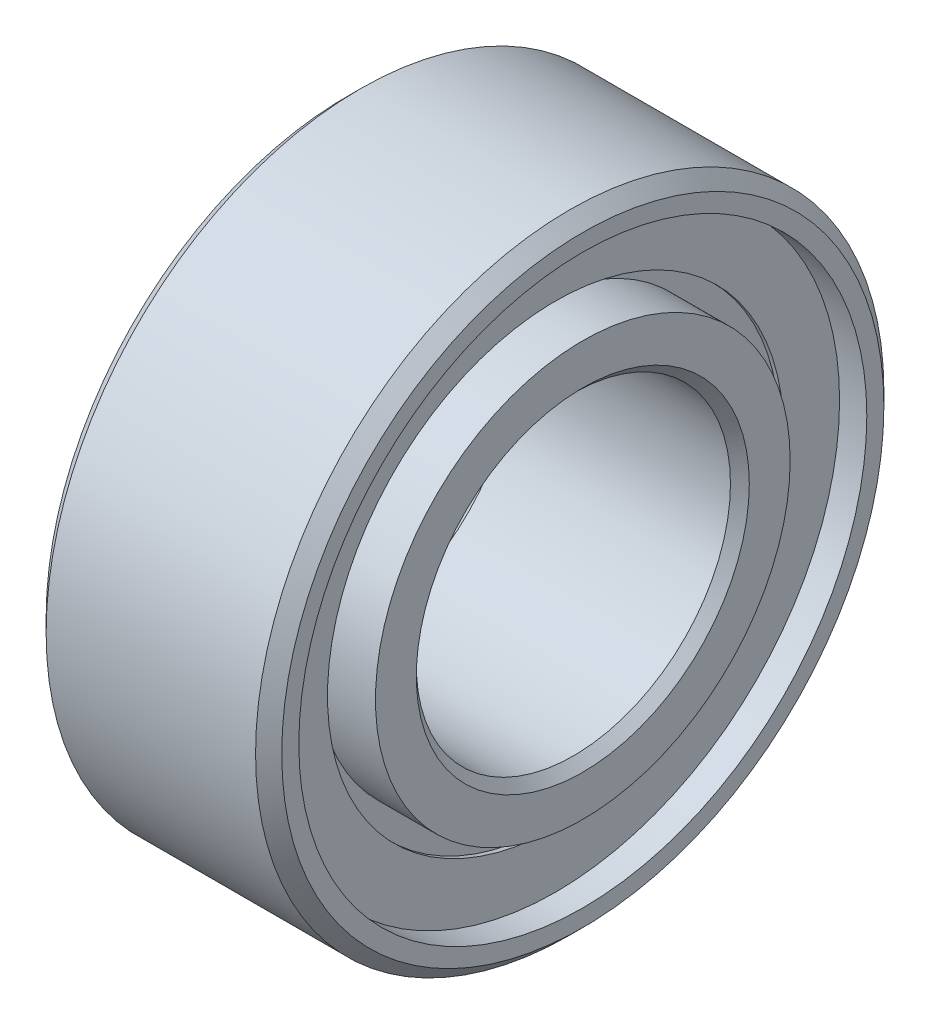
from build123d import *


with BuildPart() as part:
    # Sketch1 → Revolve1 (revolve)
    with BuildSketch(Plane.XY, mode=Mode.PRIVATE) as revolve1_sk:
        Polygon((-2.38125, 3.3655), (-2.19075, 3.175), (2.19075, 3.175), (2.38125, 3.3655), (2.38125, 4.191), (1.190625, 4.191), (1.190625, 5.7404), (1.741289063, 5.7404), (1.741289063, 4.6101), (1.830585938, 4.6101), (1.830585938, 5.7404), (2.38125, 5.7404), (2.38125, 6.085416667), (2.116666667, 6.35), (-2.116666667, 6.35), (-2.38125, 6.085416667), (-2.38125, 5.7404), (-1.830585937, 5.7404), (-1.830585937, 4.6101), (-1.741289062, 4.6101), (-1.741289062, 5.7404), (-1.190625, 5.7404), (-1.190625, 4.191), (-2.38125, 4.191), align=None)
    revolve(revolve1_sk.sketch.rotate(Axis((-2.38125, 0, 0), (1, 0, 0)), 270), axis=Axis((-2.38125, 0, 0), (1, 0, 0)))


solid = part.part
